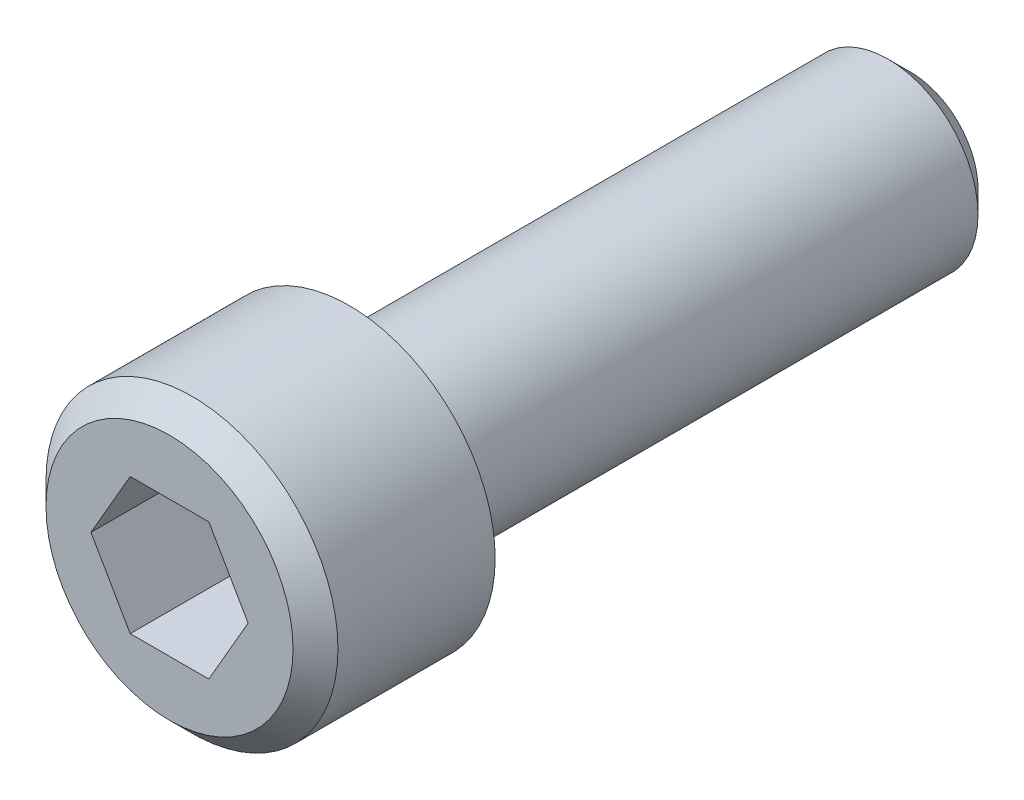
from build123d import *

# Parameters (mm, degrees)
CROQUIS1_R              = 6.5
SALIENTE_EXTRUIR1_DEPTH = 8
CROQUIS2_R              = 4
SALIENTE_EXTRUIR2_DEPTH = 25
CHAFL_N1_SIZE           = 1
CORTAR_EXTRUIR1_DEPTH   = 6


with BuildPart() as part:
    # Croquis1 → Saliente-Extruir1 (new body)
    with BuildSketch(Plane.XY):
        Circle(CROQUIS1_R)
    extrude(amount=SALIENTE_EXTRUIR1_DEPTH)

    # Croquis2 → Saliente-Extruir2 (add)
    with BuildSketch(Plane(origin=(0, 0, 0), x_dir=(-1, 0, 0), z_dir=(0, 0, -1))):
        with Locations(Location((0, 0, 0), (0, 0, 180))):
            Circle(CROQUIS2_R)
    extrude(amount=SALIENTE_EXTRUIR2_DEPTH)

    # Chaflán1
    chafl_n1_edges = [part.edges().sort_by_distance(p)[0] for p in [
        (-6.5, 0, 8),
        (-4, 0, -25),
    ]]
    chamfer(chafl_n1_edges, length=CHAFL_N1_SIZE)

    # Croquis3 → Cortar-Extruir1 (cut)
    with BuildSketch(Plane.XY.offset(8)):
        Polygon((3.5, 0), (1.75, 3.031088913), (-1.75, 3.031088913), (-3.5, 0), (-1.75, -3.031088913), (1.75, -3.031088913), align=None)
    extrude(amount=-CORTAR_EXTRUIR1_DEPTH, mode=Mode.SUBTRACT)


solid = part.part
